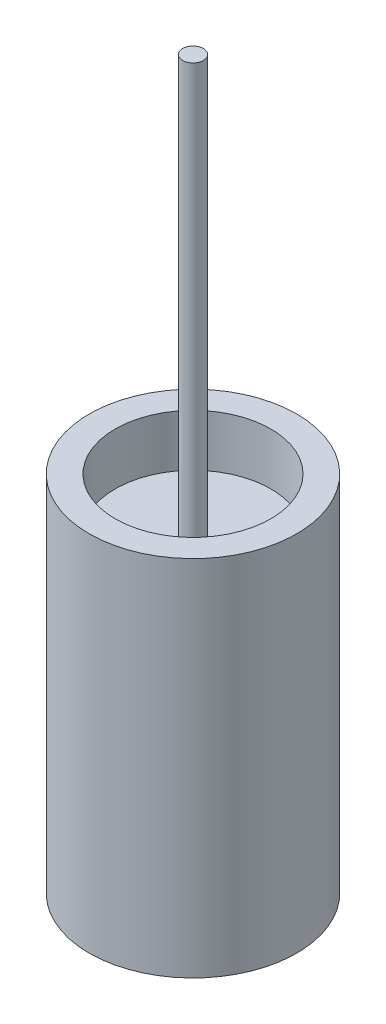
from build123d import *

# Parameters (mm, degrees)
SKETCH1_R                 = 10
BOSS_EXTRUDE2_DEPTH       = 35
SHELL1_T                  = -2.5
SHELL1_THICKNESS_2_FACE_R = 7.5
SHELL1_THICKNESS_2_DEPTH  = 27.5
SKETCH2_R                 = 1
BOSS_EXTRUDE3_DEPTH       = 40


with BuildPart() as part:
    # Sketch1 → Boss-Extrude2 (new body)
    with BuildSketch(Plane(origin=(0, 0, 0), x_dir=(1, 0, 0), z_dir=(0, 1, 0))):
        with Locations(Location((0, 0, 0), (0, 0, 270))):
            Circle(SKETCH1_R)
    extrude(amount=BOSS_EXTRUDE2_DEPTH)

    # Shell1
    shell1_openings = [part.faces().sort_by_distance(p)[0] for p in [
        (0, 35, 0),
    ]]
    offset(amount=SHELL1_T, openings=shell1_openings, kind=Kind.INTERSECTION)

    # Shell1 thickness 2 face (on inner face of the shell) → Shell1 thickness 2 (add)
    with BuildSketch(Plane(origin=(0, 2.5, 0), x_dir=(0, 0, -1), z_dir=(0, -1, 0))):
        Circle(SHELL1_THICKNESS_2_FACE_R)
    extrude(amount=-SHELL1_THICKNESS_2_DEPTH)

    # Sketch2 → Boss-Extrude3 (add)
    with BuildSketch(Plane(origin=(0, 30, 0), x_dir=(1, 0, 0), z_dir=(0, 1, 0))):
        with Locations(Location((0, 0, 0), (0, 0, 270))):
            Circle(SKETCH2_R)
    extrude(amount=BOSS_EXTRUDE3_DEPTH)


solid = part.part
